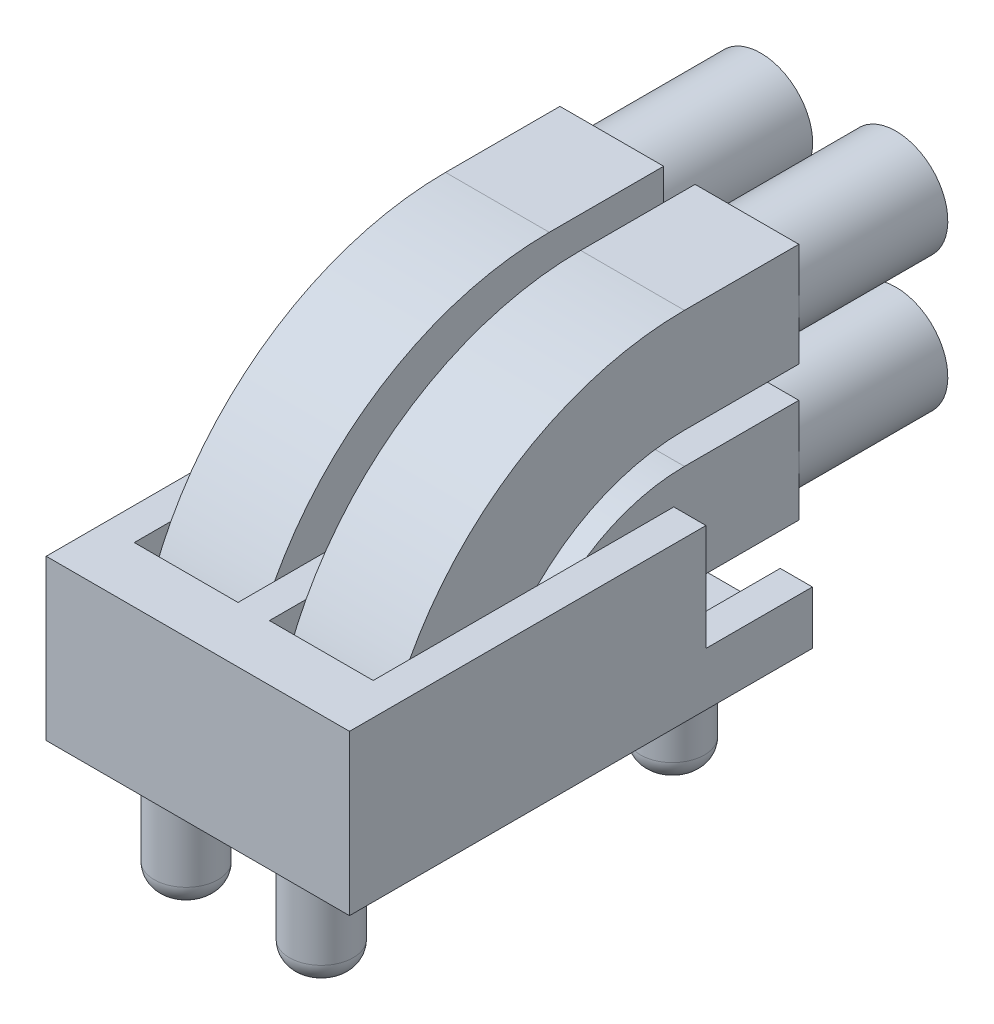
from build123d import *

# Parameters (mm, degrees)
SZKIC1_W                    = 5.7
SZKIC1_H                    = 8.7
DODANIE_WYCI_GNI_CIE1_DEPTH = 3
SZKIC5_W                    = 1.95
SZKIC5_H                    = 7.65
WYTNIJ_WYCI_GNI_CIE2_DEPTH  = 2.75
SZKIC3_W                    = 2
SZKIC3_H                    = 2
WYTNIJ_WYCI_GNI_CIE1_DEPTH  = 9.802840451
SZKIC6_R                    = 0.6
DODANIE_WYCI_GNI_CIE2_DEPTH = 2.1
ZAOKR_GLENIE1_R             = 0.4
DODANIE_WYCI_GNI_CIE3_DEPTH = 1.95
DODANIE_WYCI_GNI_CIE4_DEPTH = 1.95
SZKIC9_OUTSIDE_W            = 10.8
SZKIC9_OUTSIDE_H            = 13.3
SZKIC9_OUTSIDE_R            = 0.975
WYTNIJ_WYCI_GNI_CIE4_DEPTH  = 2.8


with BuildPart() as part:
    # Szkic1 → Dodanie-wyciągnięcie1 (new body)
    with BuildSketch(Plane(origin=(0, 0, 0), x_dir=(1, 0, 0), z_dir=(0, 1, 0))):
        Rectangle(SZKIC1_W, SZKIC1_H)
    extrude(amount=DODANIE_WYCI_GNI_CIE1_DEPTH)

    # Szkic5 → Wytnij-wyciągnięcie2 (cut)
    with BuildSketch(Plane(origin=(0, 3, 0), x_dir=(1, 0, 0), z_dir=(0, 1, 0))):
        with Locations((1.27, 0.525)):
            Rectangle(SZKIC5_W, SZKIC5_H)
        with Locations((-1.27, 0.525)):
            Rectangle(SZKIC5_W, SZKIC5_H)
    extrude(amount=-WYTNIJ_WYCI_GNI_CIE2_DEPTH, mode=Mode.SUBTRACT)

    # Szkic3 → Wytnij-wyciągnięcie1 (cut, through all)
    with BuildSketch(Plane(origin=(2.85, 0, 1.65), x_dir=(0, 0, 1), z_dir=(-1, 0, 0))):
        with Locations((-5, 2)):
            Rectangle(SZKIC3_W, SZKIC3_H)
    extrude(amount=WYTNIJ_WYCI_GNI_CIE1_DEPTH, mode=Mode.SUBTRACT)

    # Szkic6 → Dodanie-wyciągnięcie2 (add)
    with BuildSketch(Plane.XZ):
        with Locations(Location((1.27, 3.3, 0), (0, 0, 90))):
            Circle(SZKIC6_R)
        with Locations(Location((-1.27, 3.3, 0), (0, 0, 90))):
            Circle(SZKIC6_R)
        with Locations(Location((1.27, -3.3, 0), (0, 0, 90))):
            Circle(SZKIC6_R)
        with Locations(Location((-1.27, -3.3, 0), (0, 0, 90))):
            Circle(SZKIC6_R)
    extrude(amount=DODANIE_WYCI_GNI_CIE2_DEPTH)

    # Zaokrąglenie1
    zaokr_glenie1_edges = [part.edges().sort_by_distance(p)[0] for p in [
        (1.27, -2.1, 2.7),
        (-1.27, -2.1, 2.7),
        (1.27, -2.1, -3.9),
        (-1.27, -2.1, -3.9),
    ]]
    fillet(zaokr_glenie1_edges, radius=ZAOKR_GLENIE1_R)

    # Szkic7 → Dodanie-wyciągnięcie3 (add)
    with BuildSketch(Plane(origin=(0.295, 0, 0), x_dir=(0, 0, -1), z_dir=(1, 0, 0))):
        with BuildLine():
            Line((2.55, 6.1), (7.5, 6.1))
            Line((7.5, 6.1), (7.5, 4.15))
            Line((7.5, 4.15), (2.55, 4.15))
            ThreePointArc((2.55, 4.15), (-0.207716447, 3.007716447), (-1.35, 0.25))
            Line((-1.35, 0.25), (-3.3, 0.25))
            ThreePointArc((-3.3, 0.25), (-1.58657467, 4.38657467), (2.55, 6.1))
        make_face()
    dodanie_wyci_gni_cie3 = extrude(amount=DODANIE_WYCI_GNI_CIE3_DEPTH)

    # Szkic8 → Dodanie-wyciągnięcie4 (add)
    with BuildSketch(Plane(origin=(0.295, 0, 0), x_dir=(0, 0, -1), z_dir=(1, 0, 0))):
        with BuildLine():
            Line((7.5, 3.56), (2.55, 3.56))
            ThreePointArc((2.55, 3.56), (0.209476554, 2.590523446), (-0.76, 0.25))
            Line((-0.76, 0.25), (1.19, 0.25))
            ThreePointArc((1.19, 0.25), (1.588334778, 1.211665222), (2.55, 1.61))
            Line((2.55, 1.61), (7.5, 1.61))
            Line((7.5, 1.61), (7.5, 3.56))
        make_face()
    dodanie_wyci_gni_cie4 = extrude(amount=DODANIE_WYCI_GNI_CIE4_DEPTH)

    # Lustro2: Dodanie-wyciągnięcie3, Dodanie-wyciągnięcie4 across plane
    add(dodanie_wyci_gni_cie3.mirror(Plane.ZY))
    add(dodanie_wyci_gni_cie4.mirror(Plane.ZY))

    # Szkic9 outside → Wytnij-wyciągnięcie4 (cut)
    with BuildSketch(Plane(origin=(0, 0, -7.5), x_dir=(-1, 0, 0), z_dir=(0, 0, -1))):
        with Locations((0, 2)):
            Rectangle(SZKIC9_OUTSIDE_W, SZKIC9_OUTSIDE_H)
        with Locations((-1.27, 2.54)):
            Circle(SZKIC9_OUTSIDE_R, mode=Mode.SUBTRACT)
        with Locations((-1.27, 5.08)):
            Circle(SZKIC9_OUTSIDE_R, mode=Mode.SUBTRACT)
        with Locations((1.27, 5.08)):
            Circle(SZKIC9_OUTSIDE_R, mode=Mode.SUBTRACT)
        with Locations((1.27, 2.54)):
            Circle(SZKIC9_OUTSIDE_R, mode=Mode.SUBTRACT)
    extrude(amount=-WYTNIJ_WYCI_GNI_CIE4_DEPTH, mode=Mode.SUBTRACT)


solid = part.part
